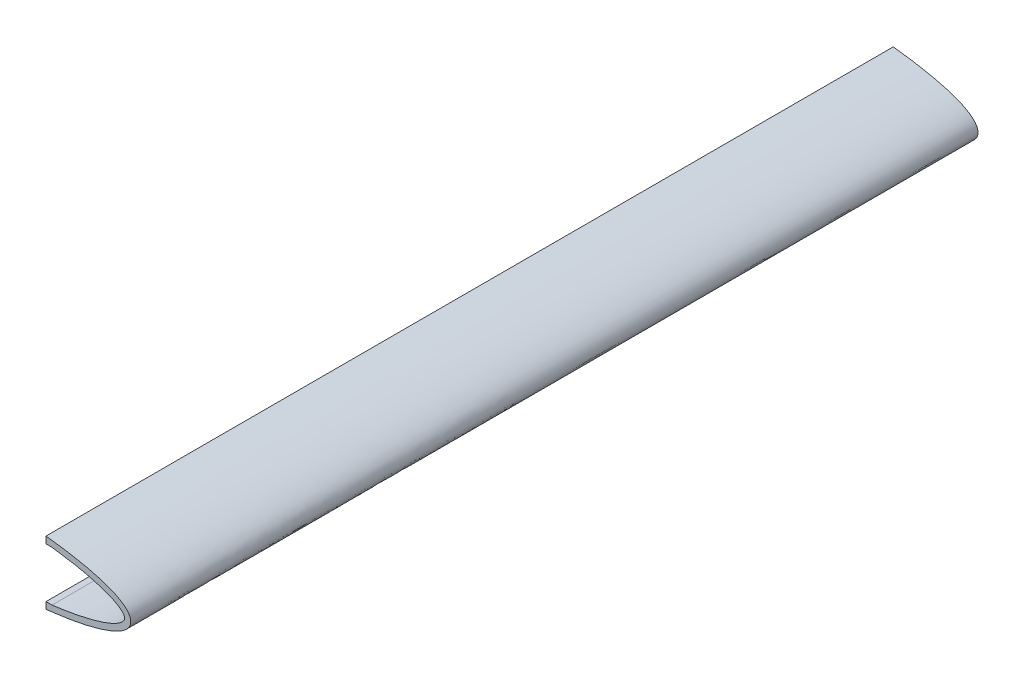
from build123d import *

# Parameters (mm, degrees)
BOSS_EXTRUDE1_DEPTH = 444.5


with BuildPart() as part:
    # Sketch1 → Boss-Extrude1 (new body)
    with BuildSketch(Plane.XY):
        with BuildLine():
            Line((0, 29.775180391), (0, 33.353963059))
            add(Edge.make_bspline(
                [(0, 0), (2.090445766, 0.23693114), (6.772462188, 0.820622556), (13.771607217, 1.904520336), (20.72003013, 3.271915787), (26.836940574, 4.792739908), (32.087579611, 6.452162768), (36.44527055, 8.234729148), (39.896116593, 10.128379148), (42.43480771, 12.13685025), (44.060818715, 14.308731932), (44.631372316, 16.676981529), (44.060818715, 19.045231127), (42.43480771, 21.217112809), (39.896116593, 23.225583911), (36.44527055, 25.119233911), (32.087579611, 26.901800291), (26.836940574, 28.561223151), (20.72003013, 30.082047272), (13.771607217, 31.449442723), (6.772462188, 32.533340502), (2.090445766, 33.117031918), (0, 33.353963059)],
                knots=[0.424329698, 0.424329698, 0.424329698, 0.424329698, 0.434027755, 0.446078201, 0.456972305, 0.466663037, 0.475120704, 0.482336018, 0.488336068, 0.493209752, 0.497165062, 0.500617192, 0.504069322, 0.508024632, 0.512898316, 0.518898366, 0.52611368, 0.534571347, 0.544262079, 0.555156183, 0.567206629, 0.576904686, 0.576904686, 0.576904686, 0.576904686], degree=3))
            Line((0, 0), (0, 3.578782668))
            Line((0, 3.578782668), (3.175, 3.578782668))
            add(Edge.make_bspline(
                [(3.175, 3.578782668), (6.924543922, 4.054747295), (14.422665679, 5.176290305), (23.601501142, 7.150917512), (29.78870277, 9.037412181), (33.179365254, 10.320777965), (35.614830582, 11.41185493), (37.861227004, 12.650616135), (39.793015813, 14.053017741), (40.882290841, 15.331540781), (41.176757391, 16.034376045), (41.263202443, 16.430507613), (41.280898779, 16.676981529), (41.263202443, 16.923455445), (41.176757391, 17.319587014), (40.882290841, 18.022422278), (39.793015813, 19.300945318), (37.861227004, 20.703346924), (35.614830582, 21.942108129), (33.179365254, 23.033185094), (29.78870277, 24.316550878), (23.601501142, 26.203045547), (14.422665679, 28.177672754), (6.924543922, 29.299215763), (3.175, 29.775180391)],
                knots=[0.42986215, 0.42986215, 0.42986215, 0.42986215, 0.44755091, 0.465239671, 0.474084051, 0.478506241, 0.482928431, 0.487350622, 0.491772812, 0.496195002, 0.498406097, 0.499511644, 0.500617192, 0.501722739, 0.502828287, 0.505039382, 0.509461572, 0.513883762, 0.518305952, 0.522728143, 0.527150333, 0.535994713, 0.553683473, 0.571372234, 0.571372234, 0.571372234, 0.571372234], degree=3))
            Line((3.175, 29.775180391), (0, 29.775180391))
        make_face()
    extrude(amount=BOSS_EXTRUDE1_DEPTH)


solid = part.part
